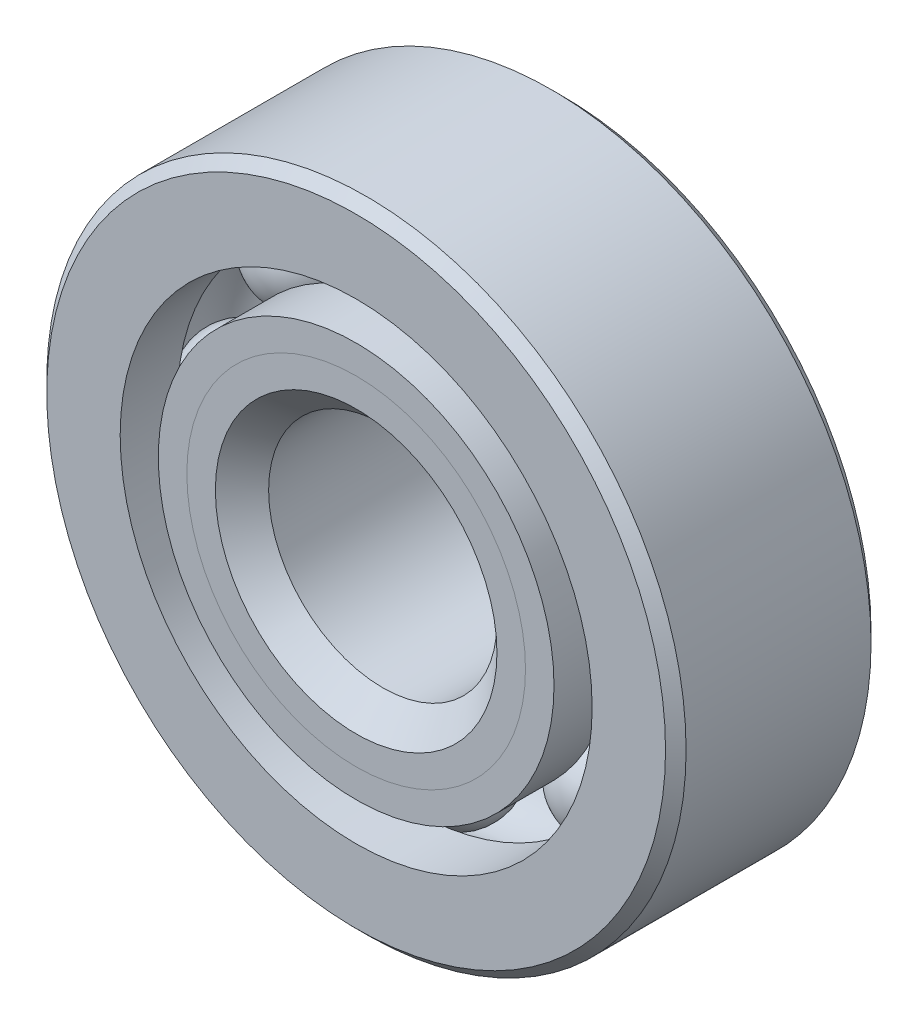
from build123d import *

# Parameters (mm, degrees)
CIRPATTERN1_COUNT = 8


with BuildPart() as part:
    # Sketch1 → Revolve1 (revolve)
    with BuildSketch(Plane(origin=(0, 0, 0), x_dir=(0, 0, -1), z_dir=(1, 0, 0))):
        with BuildLine():
            Line((3.2146875, 11.1125), (-3.2146875, 11.1125))
            Line((-3.2146875, 11.1125), (-3.571875, 10.7553125))
            Line((-3.571875, 10.7553125), (-3.571875, 8.203537088))
            Line((-3.571875, 8.203537088), (-1.5875, 8.203537088))
            ThreePointArc((-1.5875, 8.203537088), (0, 9.260976326), (1.5875, 8.203537088))
            Line((1.5875, 8.203537088), (3.571875, 8.203537088))
            Line((3.571875, 8.203537088), (3.571875, 10.7553125))
            Line((3.571875, 10.7553125), (3.2146875, 11.1125))
        make_face()
    revolve(axis=Axis((0, 0, 3.571875), (0, 0, -1)))


with BuildPart() as body_2:
    # Sketch2 → Revolve2 (revolve)
    with BuildSketch(Plane(origin=(0, 0, 0), x_dir=(0, 0, -1), z_dir=(1, 0, 0))):
        with BuildLine():
            Line((-3.571875, 6.877712912), (-1.5875, 6.877712912))
            ThreePointArc((-1.5875, 6.877712912), (-0.95372087, 6.108834098), (0, 5.820273674))
            Line((0, 5.820273674), (0, 4.894511837))
            Line((0, 4.894511837), (-2.580274462, 4.894511837))
            Line((-2.580274462, 4.894511837), (-3.571875, 5.886112374))
            Line((-3.571875, 5.886112374), (-3.571875, 6.877712912))
        make_face()
    revolve(axis=Axis((0, 0, 3.571875), (0, 0, -1)))


with BuildPart() as body_3:
    # Sketch3 → Revolve3 (revolve)
    with BuildSketch(Plane(origin=(0, 0, 0), x_dir=(0, 0, -1), z_dir=(1, 0, 0))):
        with BuildLine():
            Line((-3.571875, 5.886112374), (-2.580274462, 4.894511837))
            Line((-2.580274462, 4.894511837), (0, 4.894511837))
            Line((0, 4.894511837), (0, 5.820273674))
            ThreePointArc((0, 5.820273674), (0.95372087, 6.108834098), (1.5875, 6.877712912))
            Line((1.5875, 6.877712912), (3.571875, 6.877712912))
            Line((3.571875, 6.877712912), (3.571875, 4.3259375))
            Line((3.571875, 4.3259375), (3.2146875, 3.96875))
            Line((3.2146875, 3.96875), (-2.646113163, 3.96875))
            Line((-2.646113163, 3.96875), (-3.571875, 4.894511837))
            Line((-3.571875, 4.894511837), (-3.571875, 5.886112374))
        make_face()
    revolve(axis=Axis((0, 0, 3.571875), (0, 0, -1)))


with BuildPart() as body_4:
    # Sketch4 → Revolve4 (revolve)
    with BuildSketch(Plane(origin=(0, 0, 0), x_dir=(0, 0, -1), z_dir=(1, 0, 0))):
        with BuildLine():
            Line((-1.720351326, 7.540625), (1.720351326, 7.540625))
            ThreePointArc((1.720351326, 7.540625), (0, 9.260976326), (-1.720351326, 7.540625))
        make_face()
    revolve(axis=Axis((0, 7.540625, 1.720351326), (0, 0, -1)))


with BuildPart() as cirpattern1_1:
    # CirPattern1: pattern copy
    add(body_4.part.rotate(Axis((0, 0, -3.571875), (0, 0, 1)), 1 * 360 / CIRPATTERN1_COUNT))


with BuildPart() as cirpattern1_2:
    # CirPattern1: pattern copy
    add(body_4.part.rotate(Axis((0, 0, -3.571875), (0, 0, 1)), 2 * 360 / CIRPATTERN1_COUNT))


with BuildPart() as cirpattern1_3:
    # CirPattern1: pattern copy
    add(body_4.part.rotate(Axis((0, 0, -3.571875), (0, 0, 1)), 3 * 360 / CIRPATTERN1_COUNT))


with BuildPart() as cirpattern1_4:
    # CirPattern1: pattern copy
    add(body_4.part.rotate(Axis((0, 0, -3.571875), (0, 0, 1)), 4 * 360 / CIRPATTERN1_COUNT))


with BuildPart() as cirpattern1_5:
    # CirPattern1: pattern copy
    add(body_4.part.rotate(Axis((0, 0, -3.571875), (0, 0, 1)), 5 * 360 / CIRPATTERN1_COUNT))


with BuildPart() as cirpattern1_6:
    # CirPattern1: pattern copy
    add(body_4.part.rotate(Axis((0, 0, -3.571875), (0, 0, 1)), 6 * 360 / CIRPATTERN1_COUNT))


with BuildPart() as cirpattern1_7:
    # CirPattern1: pattern copy
    add(body_4.part.rotate(Axis((0, 0, -3.571875), (0, 0, 1)), 7 * 360 / CIRPATTERN1_COUNT))


solid = Compound([part.part, body_2.part, body_3.part, body_4.part, cirpattern1_1.part, cirpattern1_2.part, cirpattern1_3.part, cirpattern1_4.part, cirpattern1_5.part, cirpattern1_6.part, cirpattern1_7.part])
